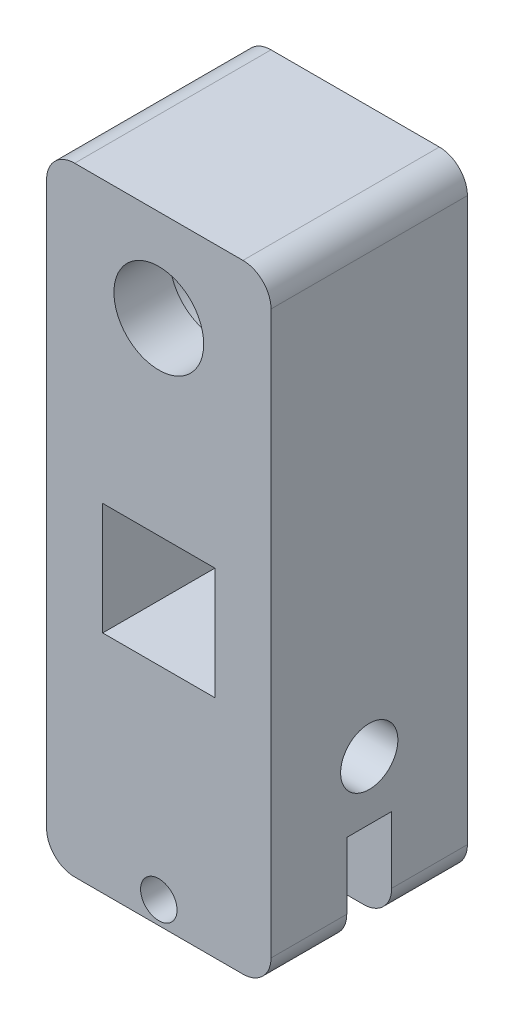
from build123d import *

# Parameters (mm, degrees)
CROQUIS1_R              = 12
CROQUIS1_R_2            = 3.25
SALIENTE_EXTRUIR1_DEPTH = 35
SALIENTE_EXTRUIR2_START = -10
CROQUIS2_R              = 12
CROQUIS2_R_2            = 8
SALIENTE_EXTRUIR2_DEPTH = 10
CROQUIS3_R              = 5.1
CROQUIS3_W              = 8
CROQUIS3_H              = 16.86
CORTAR_EXTRUIR2_DEPTH   = 123.321007599
CROQUIS4_R              = 11
CORTAR_EXTRUIR3_DEPTH   = 3.5


with BuildPart() as part:
    # Croquis1 → Saliente-Extruir1 (new body)
    # profile 1 of 2: a face of its own
    with BuildSketch(Plane.XY):
        with BuildLine():
            Line((0, 105.17), (0, 40.17))
            Line((0, 40.17), (10, 40.17))
            Line((10, 40.17), (10, 60.17))
            Line((10, 60.17), (30, 60.17))
            Line((30, 60.17), (30, 40.17))
            Line((30, 40.17), (40, 40.17))
            Line((40, 40.17), (40, 105.17))
            ThreePointArc((40, 105.17), (38.535533906, 108.705533906), (35, 110.17))
            Line((35, 110.17), (5, 110.17))
            ThreePointArc((5, 110.17), (1.464466094, 108.705533906), (0, 105.17))
        make_face()
        with Locations((20, 93.74)):
            Circle(CROQUIS1_R, mode=Mode.SUBTRACT)
    # profile 2 of 2: a face of its own
    with BuildSketch(Plane.XY):
        with BuildLine():
            Line((5, 0), (35, 0))
            ThreePointArc((35, 0), (38.535533906, 1.464466094), (40, 5))
            Line((40, 5), (40, 40.17))
            Line((40, 40.17), (0, 40.17))
            Line((0, 40.17), (0, 5))
            ThreePointArc((0, 5), (1.464466094, 1.464466094), (5, 0))
        make_face()
        with Locations((20, 4)):
            Circle(CROQUIS1_R_2, mode=Mode.SUBTRACT)
    extrude(amount=SALIENTE_EXTRUIR1_DEPTH)

    # Croquis2 → Saliente-Extruir2 (add)
    with BuildSketch(Plane.XY.offset(35).offset(SALIENTE_EXTRUIR2_START)):
        with Locations((20, 93.74)):
            Circle(CROQUIS2_R)
        with Locations((20, 93.74)):
            Circle(CROQUIS2_R_2, mode=Mode.SUBTRACT)
    extrude(amount=SALIENTE_EXTRUIR2_DEPTH)

    # Croquis3 → Cortar-Extruir2 (cut, through all)
    with BuildSketch(Plane.ZY):
        with Locations((17.5, 27.36)):
            Circle(CROQUIS3_R)
        with Locations((17.5, 8.43)):
            Rectangle(CROQUIS3_W, CROQUIS3_H)
    extrude(amount=-CORTAR_EXTRUIR2_DEPTH, mode=Mode.SUBTRACT)

    # Croquis4 → Cortar-Extruir3 (cut)
    with BuildSketch(Plane.ZY):
        with Locations((17.5, 27.36)):
            Circle(CROQUIS4_R)
    extrude(amount=-CORTAR_EXTRUIR3_DEPTH, mode=Mode.SUBTRACT)


solid = part.part
